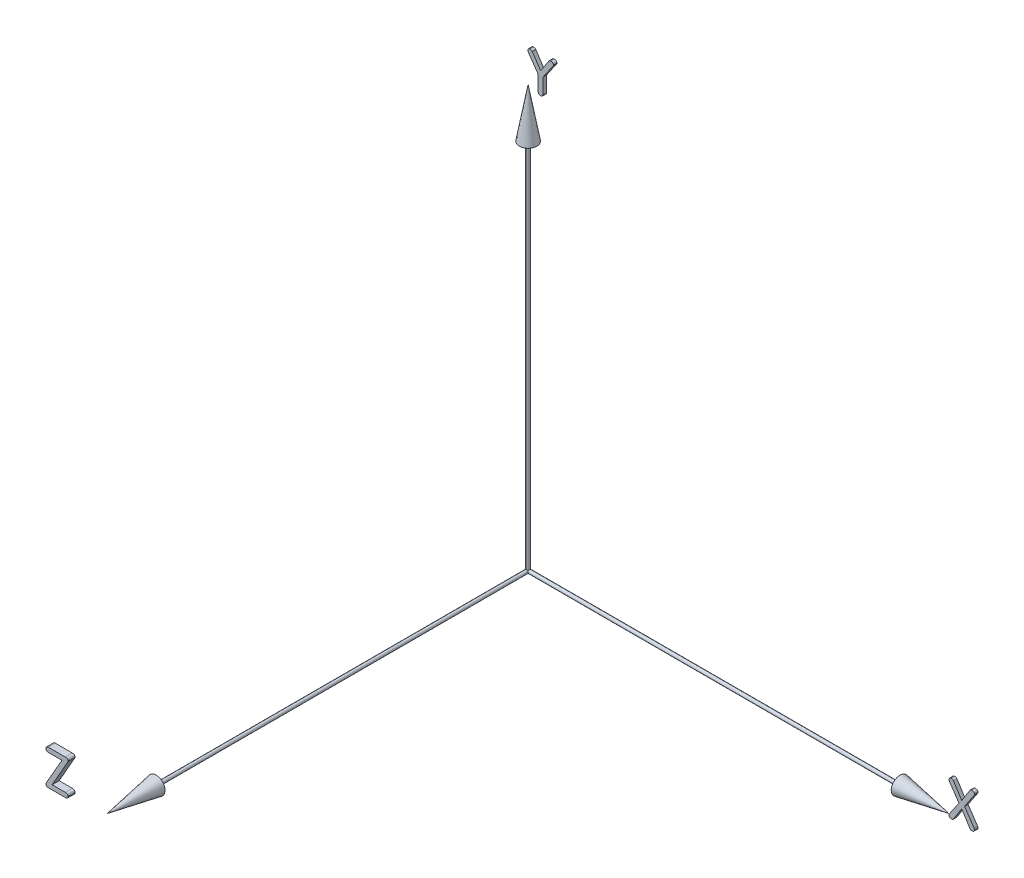
from build123d import *

# Parameters (mm, degrees)
R_P_TITION_CIRCULAIRE1_COUNT = 2
R_P_TITION_CIRCULAIRE1_ANGLE = 90
EXTRUSION1_DEPTH             = 0.5
EXTRUSION1_2_DEPTH           = 0.5
BOSS_EXTRU_1_DEPTH           = 1


with BuildPart() as part:
    # Esquisse1 → Révolution1 (revolve)
    with BuildSketch(Plane.XY, mode=Mode.PRIVATE) as r_volution1_sk:
        Polygon((0, 0.25), (53, 0.25), (53, 1.25), (60, 0), (0, 0), align=None)
    r_volution1 = revolve(r_volution1_sk.sketch.rotate(Axis((-16.170182965, 0, 0), (1, 0, 0)), 90), axis=Axis((-16.170182965, 0, 0), (1, 0, 0)))

    # Répétition circulaire1: Révolution1 ×2 about axis
    r_p_tition_circulaire1_axis = Axis((0, 0, -1.1), (0, 0, 1))
    for i in range(1, R_P_TITION_CIRCULAIRE1_COUNT):
        add(r_volution1.rotate(r_p_tition_circulaire1_axis, i * R_P_TITION_CIRCULAIRE1_ANGLE / (R_P_TITION_CIRCULAIRE1_COUNT - 1)))

    # Répétition circulaire2 copy 1 sketch → Répétition circulaire2 copy 1 (revolve)
    with BuildSketch(Plane(origin=(0, 0, 0), x_dir=(0, 0, 1), z_dir=(0, -1, 0))):
        Polygon((0, 0.25), (53, 0.25), (53, 1.25), (60, 0), (0, 0), align=None)
    revolve(axis=Axis((0, 0, -16.170182965), (0, 0, 1)))


with BuildPart() as body_2:
    # Esquisse2 → Extrusion1 (new body)
    with BuildSketch(Plane.XY):
        with BuildLine():
            Line((62.706473214, 2.498883929), (64.053571429, 0.488839286))
            add(Edge.make_bspline(
                [(64.053571429, 0.488839286), (64.06311817, 0.472989079), (64.081338188, 0.442738858), (64.10313896, 0.398022927), (64.11487848, 0.355110445), (64.117194406, 0.327808059), (64.118303571, 0.314732143)],
                knots=[0, 0, 0, 0, 1.180873257, 2.253704243, 3.163647556, 4, 4, 4, 4], degree=3))
            add(Edge.make_bspline(
                [(64.118303571, 0.314732143), (64.117620171, 0.290003143), (64.116322631, 0.24305134), (64.096056307, 0.177939131), (64.066503493, 0.121377122), (64.021607196, 0.07652892), (63.965903746, 0.041594611), (63.897770593, 0.017386403), (63.818435774, 0.00155608), (63.761247705, 0.000538002), (63.731026786, 0)],
                knots=[0, 0, 0, 0, 1.037273805, 1.969423578, 2.846179995, 3.699514158, 4.608183004, 5.594981275, 6.729072711, 8, 8, 8, 8], degree=3))
            add(Edge.make_bspline(
                [(63.731026786, 0), (63.703615449, 0.001575154), (63.651170431, 0.004588834), (63.577679867, 0.031817638), (63.514087782, 0.075946455), (63.483332063, 0.117290367), (63.467633929, 0.138392857)],
                knots=[0, 0, 0, 0, 1.055810902, 2.020040942, 2.989402176, 4, 4, 4, 4], degree=3))
            Line((63.467633929, 0.138392857), (62.296875, 1.991071429))
            Line((62.296875, 1.991071429), (61.125, 0.138392857))
            add(Edge.make_bspline(
                [(61.125, 0.138392857), (61.108303342, 0.117057489), (61.07428674, 0.073590301), (60.99841107, 0.029833122), (60.906419762, 0.004369484), (60.839480974, 0.001525607), (60.803571429, 0)],
                knots=[0, 0, 0, 0, 0.884409937, 1.801834945, 2.82078675, 4, 4, 4, 4], degree=3))
            add(Edge.make_bspline(
                [(60.803571429, 0), (60.778914756, 0.000553731), (60.732008627, 0.001607132), (60.66700198, 0.017505478), (60.611121186, 0.042185835), (60.565651306, 0.077451777), (60.529258201, 0.122648042), (60.50576713, 0.178750119), (60.489124824, 0.243467609), (60.488208591, 0.29005329), (60.487723214, 0.314732143)],
                knots=[0, 0, 0, 0, 1.156110421, 2.199350441, 3.122571333, 4.00740987, 4.878494053, 5.817637966, 6.843889579, 8, 8, 8, 8], degree=3))
            add(Edge.make_bspline(
                [(60.487723214, 0.314732143), (60.490042683, 0.345880399), (60.494678578, 0.408136068), (60.525018542, 0.462694192), (60.540178571, 0.489955357)],
                knots=[0, 0, 0, 0, 1.000656073, 2, 2, 2, 2], degree=3))
            Line((60.540178571, 0.489955357), (61.900669643, 2.5))
            Line((61.900669643, 2.5), (60.540178571, 4.508928571))
            add(Edge.make_bspline(
                [(60.540178571, 4.508928571), (60.525018181, 4.536191641), (60.494496227, 4.59107955), (60.489990784, 4.653734101), (60.487723214, 4.685267857)],
                knots=[0, 0, 0, 0, 0.993408919, 2, 2, 2, 2], degree=3))
            add(Edge.make_bspline(
                [(60.487723214, 4.685267857), (60.488217703, 4.709938697), (60.489151139, 4.756509251), (60.505678714, 4.821327632), (60.529666243, 4.877365353), (60.5648892, 4.923713377), (60.611575725, 4.957611517), (60.666925092, 4.982586255), (60.732031372, 4.998365731), (60.778922592, 4.999436919), (60.803571429, 5)],
                knots=[0, 0, 0, 0, 1.155654958, 2.181502266, 3.120276192, 4.004766136, 4.878658842, 5.80151602, 6.844345042, 8, 8, 8, 8], degree=3))
            add(Edge.make_bspline(
                [(60.803571429, 5), (60.839103528, 4.998442396), (60.90565965, 4.995524807), (60.997311791, 4.970184272), (61.073579016, 4.92608429), (61.107958785, 4.882229048), (61.125, 4.860491071)],
                knots=[0, 0, 0, 0, 1.165533591, 2.183191995, 3.099452474, 4, 4, 4, 4], degree=3))
            Line((61.125, 4.860491071), (62.296875, 3.013392857))
            Line((62.296875, 3.013392857), (63.467633929, 4.860491071))
            add(Edge.make_bspline(
                [(63.467633929, 4.860491071), (63.483727275, 4.881919123), (63.514771518, 4.923254072), (63.578061167, 4.968814917), (63.651682233, 4.995035052), (63.704027542, 4.998310535), (63.731026786, 5)],
                knots=[0, 0, 0, 0, 1.028845601, 1.984654605, 2.960502818, 4, 4, 4, 4], degree=3))
            add(Edge.make_bspline(
                [(63.731026786, 5), (63.761239161, 4.999449652), (63.818411062, 4.998408209), (63.897852527, 4.982731995), (63.965463161, 4.958104019), (64.02235585, 4.924779798), (64.066104087, 4.878571805), (64.096134747, 4.822144167), (64.116299863, 4.756924482), (64.117612317, 4.709988516), (64.118303571, 4.685267857)],
                knots=[0, 0, 0, 0, 1.270448917, 2.404113486, 3.39054033, 4.290589112, 5.154891296, 6.031317705, 6.963116621, 8, 8, 8, 8], degree=3))
            add(Edge.make_bspline(
                [(64.118303571, 4.685267857), (64.117084685, 4.671355109), (64.114367984, 4.640345847), (64.093783303, 4.592032527), (64.065096912, 4.536250442), (64.039520655, 4.498255186), (64.025669643, 4.477678571)],
                knots=[0, 0, 0, 0, 0.724463893, 1.614712716, 2.708229882, 4, 4, 4, 4], degree=3))
            Line((64.025669643, 4.477678571), (62.706473214, 2.498883929))
        make_face()
    extrude(amount=EXTRUSION1_DEPTH)


with BuildPart() as body_3:
    # Esquisse2 → Extrusion1 2 (new body)
    with BuildSketch(Plane.XY):
        with BuildLine():
            Line((2.642857143, 62.496651786), (2.642857143, 60.314732143))
            add(Edge.make_bspline(
                [(2.642857143, 60.314732143), (2.642179322, 60.289997299), (2.640892375, 60.243034401), (2.620554158, 60.177997494), (2.59112949, 60.12093935), (2.545019192, 60.076946625), (2.488884944, 60.040955094), (2.419518916, 60.017884183), (2.338951797, 60.001306685), (2.280984133, 60.000455151), (2.25, 60)],
                knots=[0, 0, 0, 0, 1.028054548, 1.951919403, 2.820883235, 3.677544513, 4.578137139, 5.585329752, 6.709341418, 8, 8, 8, 8], degree=3))
            add(Edge.make_bspline(
                [(2.25, 60), (2.224975471, 60.000556757), (2.177342776, 60.001616509), (2.111211644, 60.017500685), (2.054351864, 60.04222735), (2.007574579, 60.077028465), (1.971570385, 60.122978924), (1.945908418, 60.178254071), (1.931863944, 60.24374716), (1.929713362, 60.290112636), (1.928571429, 60.314732143)],
                knots=[0, 0, 0, 0, 1.163568472, 2.214783019, 3.14592832, 4.036996539, 4.900661769, 5.839040936, 6.85255686, 8, 8, 8, 8], degree=3))
            Line((1.928571429, 60.314732143), (1.928571429, 62.4765625))
            Line((1.928571429, 62.4765625), (0.521205357, 64.503348214))
            add(Edge.make_bspline(
                [(0.521205357, 64.503348214), (0.504743119, 64.53088743), (0.471238328, 64.586936652), (0.466629859, 64.652114488), (0.464285714, 64.685267857)],
                knots=[0, 0, 0, 0, 0.982679656, 2, 2, 2, 2], degree=3))
            add(Edge.make_bspline(
                [(0.464285714, 64.685267857), (0.464780203, 64.709938697), (0.465713639, 64.756509251), (0.482241214, 64.821327632), (0.506228743, 64.877365353), (0.5414517, 64.923713377), (0.588138225, 64.957611517), (0.643487592, 64.982586255), (0.708593872, 64.998365731), (0.755485092, 64.999436919), (0.780133929, 65)],
                knots=[0, 0, 0, 0, 1.155654958, 2.181502266, 3.120276192, 4.004766136, 4.878658842, 5.80151602, 6.844345042, 8, 8, 8, 8], degree=3))
            add(Edge.make_bspline(
                [(0.780133929, 65), (0.815316331, 64.998923194), (0.881568077, 64.996895468), (0.971903822, 64.971096871), (1.047870943, 64.929372996), (1.082246747, 64.887086423), (1.099330357, 64.866071429)],
                knots=[0, 0, 0, 0, 1.168240049, 2.199904949, 3.105413715, 4, 4, 4, 4], degree=3))
            Line((1.099330357, 64.866071429), (2.279017857, 63.071428571))
            Line((2.279017857, 63.071428571), (3.457589286, 64.866071429))
            add(Edge.make_bspline(
                [(3.457589286, 64.866071429), (3.473218832, 64.88694123), (3.50374964, 64.927708373), (3.568364369, 64.968898249), (3.640619633, 64.996787618), (3.692792863, 64.998902544), (3.719866071, 65)],
                knots=[0, 0, 0, 0, 1.010489968, 1.973894555, 2.948633704, 4, 4, 4, 4], degree=3))
            add(Edge.make_bspline(
                [(3.719866071, 65), (3.750078447, 64.999449652), (3.807250348, 64.998408209), (3.886691813, 64.982731995), (3.954302447, 64.958104019), (4.011195136, 64.924779798), (4.054943372, 64.878571805), (4.084974033, 64.822144167), (4.105139149, 64.756924482), (4.106451602, 64.709988516), (4.107142857, 64.685267857)],
                knots=[0, 0, 0, 0, 1.270448917, 2.404113486, 3.39054033, 4.290589112, 5.154891296, 6.031317705, 6.963116621, 8, 8, 8, 8], degree=3))
            add(Edge.make_bspline(
                [(4.107142857, 64.685267857), (4.105569634, 64.670602333), (4.102064054, 64.637923447), (4.079830647, 64.587272649), (4.044555615, 64.531551555), (4.01422694, 64.494459735), (3.997767857, 64.474330357)],
                knots=[0, 0, 0, 0, 0.728797295, 1.623964069, 2.710547917, 4, 4, 4, 4], degree=3))
            Line((3.997767857, 64.474330357), (2.642857143, 62.496651786))
        make_face()
    extrude(amount=EXTRUSION1_2_DEPTH)


with BuildPart() as body_4:
    # Esquisse3 → Boss.-Extru.1 (new body)
    with BuildSketch(Plane.XY.offset(60)):
        with BuildLine():
            Line((-6.839065147, 0.642857143), (-4.959600862, 0.642857143))
            add(Edge.make_bspline(
                [(-4.959600862, 0.642857143), (-4.929375091, 0.64232749), (-4.872177842, 0.641325211), (-4.792903574, 0.625390677), (-4.724387852, 0.601445178), (-4.668947676, 0.565106101), (-4.624074899, 0.519180589), (-4.594571429, 0.461519915), (-4.574207121, 0.394959795), (-4.572976454, 0.346903359), (-4.572324076, 0.321428571)],
                knots=[0, 0, 0, 0, 1.258373533, 2.381262828, 3.358313866, 4.266397696, 5.122484846, 6.004202786, 6.942024946, 8, 8, 8, 8], degree=3))
            add(Edge.make_bspline(
                [(-4.572324076, 0.321428571), (-4.573086869, 0.296363306), (-4.574546763, 0.248391356), (-4.593946596, 0.18175002), (-4.624874154, 0.12470142), (-4.668114721, 0.077452717), (-4.725099997, 0.043169196), (-4.792399416, 0.016601415), (-4.872435421, 0.003485095), (-4.929433779, 0.001206156), (-4.959600862, 0)],
                knots=[0, 0, 0, 0, 1.043515683, 1.997165386, 2.866106551, 3.734353395, 4.634922528, 5.618458819, 6.739540006, 8, 8, 8, 8], degree=3))
            Line((-4.959600862, 0), (-7.399333005, 0))
            add(Edge.make_bspline(
                [(-7.399333005, 0), (-7.423981558, 0.000563207), (-7.470872239, 0.001634634), (-7.53598212, 0.017412511), (-7.591319792, 0.042392444), (-7.63804685, 0.076272578), (-7.672908279, 0.122415351), (-7.69749865, 0.177802219), (-7.713696783, 0.24240006), (-7.71466716, 0.288954022), (-7.715181219, 0.313616071)],
                knots=[0, 0, 0, 0, 1.157958825, 2.202866789, 3.127563739, 4.003198602, 4.889451829, 5.814148779, 6.842041175, 8, 8, 8, 8], degree=3))
            add(Edge.make_bspline(
                [(-7.715181219, 0.313616071), (-7.711946044, 0.342746389), (-7.704853525, 0.406609205), (-7.674674676, 0.463486369), (-7.658261576, 0.494419643)],
                knots=[0, 0, 0, 0, 0.912277908, 2, 2, 2, 2], degree=3))
            Line((-7.658261576, 0.494419643), (-5.445091933, 4.357142857))
            Line((-5.445091933, 4.357142857), (-7.399333005, 4.357142857))
            add(Edge.make_bspline(
                [(-7.399333005, 4.357142857), (-7.423929026, 4.358351927), (-7.470612726, 4.360646764), (-7.536422146, 4.373931104), (-7.591382893, 4.400842529), (-7.638133571, 4.435688381), (-7.672909454, 4.48298536), (-7.6976943, 4.539763835), (-7.713560644, 4.605919885), (-7.714623062, 4.653548856), (-7.715181219, 4.678571429)],
                knots=[0, 0, 0, 0, 1.145312486, 2.173824069, 3.094826245, 3.970499645, 4.859913264, 5.789329549, 6.838592125, 8, 8, 8, 8], degree=3))
            add(Edge.make_bspline(
                [(-7.715181219, 4.678571429), (-7.714721662, 4.703995674), (-7.713859569, 4.751689604), (-7.697128472, 4.817863881), (-7.673669383, 4.875060906), (-7.637290788, 4.921301105), (-7.592147448, 4.95793048), (-7.535855495, 4.982429747), (-7.470909698, 4.99841203), (-7.423994464, 4.999452871), (-7.399333005, 5)],
                knots=[0, 0, 0, 0, 1.177412005, 2.208734447, 3.152945062, 4.02767554, 4.913099734, 5.825774102, 6.857096544, 8, 8, 8, 8], degree=3))
            Line((-7.399333005, 5), (-4.959600862, 5))
            add(Edge.make_bspline(
                [(-4.959600862, 5), (-4.929417109, 4.999303575), (-4.872368891, 4.99798731), (-4.792638117, 4.984160951), (-4.725204318, 4.959130298), (-4.668183705, 4.925961195), (-4.625277188, 4.879995067), (-4.593884729, 4.825098676), (-4.574553697, 4.760565612), (-4.573089638, 4.714053497), (-4.572324076, 4.689732143)],
                knots=[0, 0, 0, 0, 1.277772528, 2.415029183, 3.407142368, 4.312379558, 5.181664086, 6.03567913, 6.972849479, 8, 8, 8, 8], degree=3))
            add(Edge.make_bspline(
                [(-4.572324076, 4.689732143), (-4.573401597, 4.6773797), (-4.575761455, 4.650326865), (-4.589576498, 4.60694187), (-4.610526916, 4.557092238), (-4.629956322, 4.522868181), (-4.640404433, 4.504464286)],
                knots=[0, 0, 0, 0, 0.745022783, 1.631659242, 2.726431123, 4, 4, 4, 4], degree=3))
            Line((-4.640404433, 4.504464286), (-6.839065147, 0.642857143))
        make_face()
    extrude(amount=BOSS_EXTRU_1_DEPTH)


solid = Compound([part.part, body_2.part, body_3.part, body_4.part])
